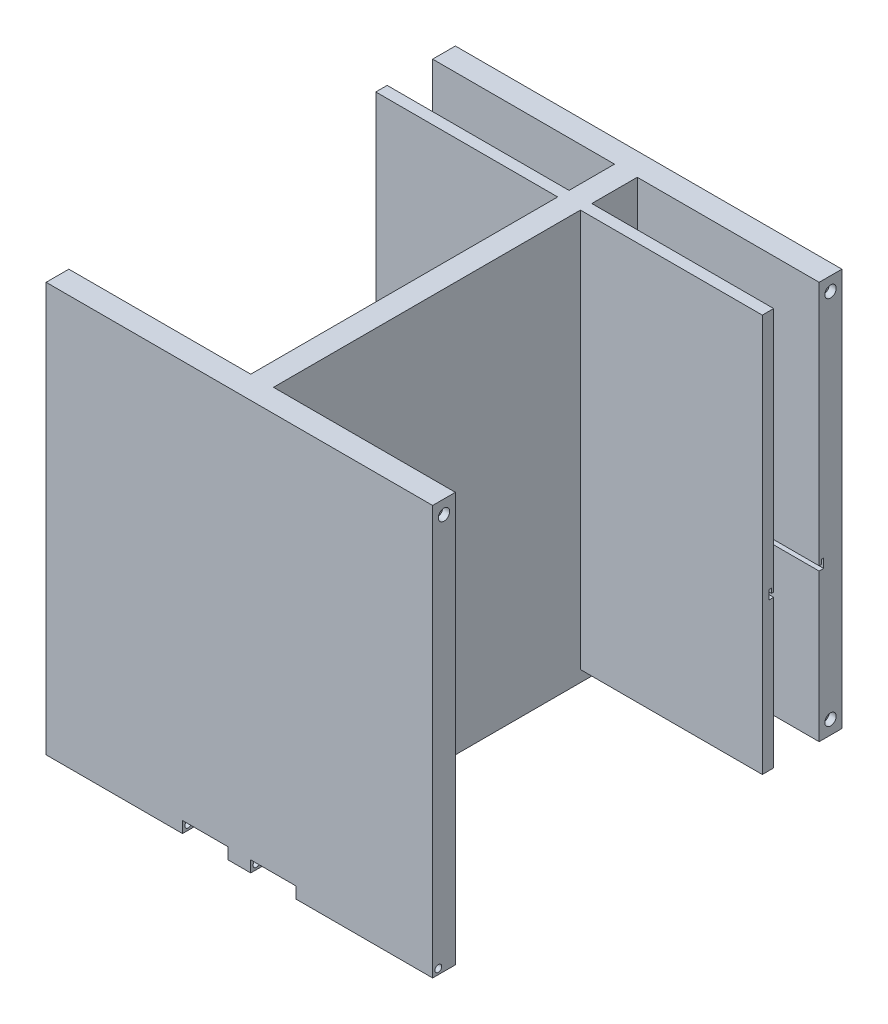
from build123d import *

# Parameters (mm, degrees)
SKETCH1_W                = 90
SKETCH1_H                = 90
BOSS_EXTRUDE1_DEPTH      = 90
SKETCH4_W                = 40
SKETCH4_H                = 80
CUT_EXTRUDE3_DEPTH       = 90
SKETCH6_W                = 10
SKETCH6_H                = 2.5
CUT_EXTRUDE5_DEPTH       = 10
CUT_EXTRUDE6_DEPTH       = 90
CUT_EXTRUDE7_DEPTH       = 90
SKETCH10_W               = 2.5
SKETCH10_H               = 90
BOSS_EXTRUDE2_DEPTH      = 40
SKETCH11_W               = 2.5
SKETCH11_H               = 90
BOSS_EXTRUDE3_DEPTH      = 40
CUT_EXTRUDE10_DEPTH      = 37.5
SKETCH16_R               = 0.75
CUT_EXTRUDE12_DEPTH      = 1.5
CUT_EXTRUDE13_DEPTH      = 111.227038425
CUT_EXTRUDE13_DEPTH_BACK = 111.227038425
SKETCH17_R               = 0.75
SKETCH21_W               = 85
SKETCH21_H               = 2.5
CUT_EXTRUDE14_DEPTH      = 40
SKETCH22_W               = 85
SKETCH22_H               = 2.5
CUT_EXTRUDE15_DEPTH      = 40
SKETCH23_R               = 1.25
CUT_EXTRUDE16_DEPTH      = 1.5
SKETCH24_R               = 1.25
CUT_EXTRUDE17_DEPTH      = 1.5


with BuildPart() as part:
    # Sketch1 → Boss-Extrude1 (new body)
    with BuildSketch(Plane(origin=(0, 0, 0), x_dir=(1, 0, 0), z_dir=(0, 1, 0))):
        Rectangle(SKETCH1_W, SKETCH1_H)
    extrude(amount=BOSS_EXTRUDE1_DEPTH)

    # Sketch4 → Cut-Extrude3 (cut)
    with BuildSketch(Plane(origin=(0, 90, 0), x_dir=(1, 0, 0), z_dir=(0, 1, 0))):
        with Locations((-22.5, 0)):
            Rectangle(SKETCH4_W, SKETCH4_H)
        with Locations((22.5, 0)):
            Rectangle(SKETCH4_W, SKETCH4_H)
    extrude(amount=-CUT_EXTRUDE3_DEPTH, mode=Mode.SUBTRACT)

    # Sketch6 → Cut-Extrude5 (cut)
    with BuildSketch(Plane.XY.offset(45)):
        with Locations((7.5, 1.25)):
            Rectangle(SKETCH6_W, SKETCH6_H)
        with Locations((-7.5, 1.25)):
            Rectangle(SKETCH6_W, SKETCH6_H)
    extrude(amount=-CUT_EXTRUDE5_DEPTH, mode=Mode.SUBTRACT)

    # Sketch7 → Cut-Extrude6 (cut)
    with BuildSketch(Plane(origin=(0, 90, 0), x_dir=(1, 0, 0), z_dir=(0, 1, 0))):
        Polygon((42.5, 40), (42.5, 45), (45, 45), (45, -45), (42.5, -45), (42.5, -40), align=None)
    extrude(amount=-CUT_EXTRUDE6_DEPTH, mode=Mode.SUBTRACT)

    # Sketch8 → Cut-Extrude7 (cut)
    with BuildSketch(Plane(origin=(0, 90, 0), x_dir=(1, 0, 0), z_dir=(0, 1, 0))):
        Polygon((-42.5, 40), (-42.5, 45), (-45, 45), (-45, -45), (-42.5, -45), (-42.5, -42.5), align=None)
    extrude(amount=-CUT_EXTRUDE7_DEPTH, mode=Mode.SUBTRACT)

    # Sketch10 → Boss-Extrude2 (add)
    with BuildSketch(Plane.ZY.offset(2.5)):
        with Locations((-28.75, 45)):
            Rectangle(SKETCH10_W, SKETCH10_H)
    extrude(amount=BOSS_EXTRUDE2_DEPTH)

    # Sketch11 → Boss-Extrude3 (add)
    with BuildSketch(Plane(origin=(2.5, 0, 0), x_dir=(0, 0, -1), z_dir=(1, 0, 0))):
        with Locations((28.75, 45)):
            Rectangle(SKETCH11_W, SKETCH11_H)
    extrude(amount=BOSS_EXTRUDE3_DEPTH)

    # Sketch13 → Cut-Extrude10 (cut)
    with BuildSketch(Plane(origin=(42.5, 0, 0), x_dir=(0, 0, -1), z_dir=(1, 0, 0))):
        Polygon((40, 36), (40.5, 36), (40.5, 37), (41, 37), (41, 35), (40, 35), align=None)
        Polygon((29, 35), (30, 35), (30, 36), (29.5, 36), (29.5, 37), (29, 37), align=None)
    cut_extrude10 = extrude(amount=-CUT_EXTRUDE10_DEPTH, mode=Mode.SUBTRACT)

    # Mirror1: Cut-Extrude10 across plane
    add(cut_extrude10.mirror(Plane.ZY), mode=Mode.SUBTRACT)

    # Sketch16 → Cut-Extrude12 (cut)
    with BuildSketch(Plane(origin=(-12.5, 0, 0), x_dir=(0, 0, -1), z_dir=(1, 0, 0))):
        with Locations((-43.75, 1.2)):
            Circle(SKETCH16_R)
    extrude(amount=-CUT_EXTRUDE12_DEPTH, mode=Mode.SUBTRACT)

    # Sketch17 → Cut-Extrude13 (cut, two sides: drawn at the far end of the back side and taken through both)
    with BuildSketch(Plane.ZY.offset(2.5).offset(-CUT_EXTRUDE13_DEPTH_BACK)):
        with Locations(Location((43.75, 1.2, 0), (0, 0, 180))):
            Circle(SKETCH17_R)
    extrude(amount=CUT_EXTRUDE13_DEPTH + CUT_EXTRUDE13_DEPTH_BACK, mode=Mode.SUBTRACT)

    # Sketch21 → Cut-Extrude14 (cut)
    with BuildSketch(Plane(origin=(42.5, 0, 0), x_dir=(0, 0, -1), z_dir=(1, 0, 0))):
        with Locations((2.5, 1.25)):
            Rectangle(SKETCH21_W, SKETCH21_H)
    extrude(amount=-CUT_EXTRUDE14_DEPTH, mode=Mode.SUBTRACT)

    # Sketch22 → Cut-Extrude15 (cut)
    with BuildSketch(Plane.ZY.offset(42.5)):
        with Locations((-2.5, 1.25)):
            Rectangle(SKETCH22_W, SKETCH22_H)
    extrude(amount=-CUT_EXTRUDE15_DEPTH, mode=Mode.SUBTRACT)

    # Sketch23 → Cut-Extrude16 (cut)
    with BuildSketch(Plane(origin=(42.5, 0, 0), x_dir=(0, 0, -1), z_dir=(1, 0, 0))):
        with Locations((42.5, 87)):
            Circle(SKETCH23_R)
        with Locations(Location((42.5, 5.5, 0), (0, 0, 180))):
            Circle(SKETCH23_R)
    cut_extrude16 = extrude(amount=-CUT_EXTRUDE16_DEPTH, mode=Mode.SUBTRACT)

    # Sketch24 → Cut-Extrude17 (cut)
    with BuildSketch(Plane(origin=(42.5, 0, 0), x_dir=(0, 0, -1), z_dir=(1, 0, 0))):
        with Locations((-42.5, 87)):
            Circle(SKETCH24_R)
    cut_extrude17 = extrude(amount=-CUT_EXTRUDE17_DEPTH, mode=Mode.SUBTRACT)

    # Mirror2: Cut-Extrude16, Cut-Extrude17 across plane
    add(cut_extrude16.mirror(Plane.ZY), mode=Mode.SUBTRACT)
    add(cut_extrude17.mirror(Plane.ZY), mode=Mode.SUBTRACT)


solid = part.part
